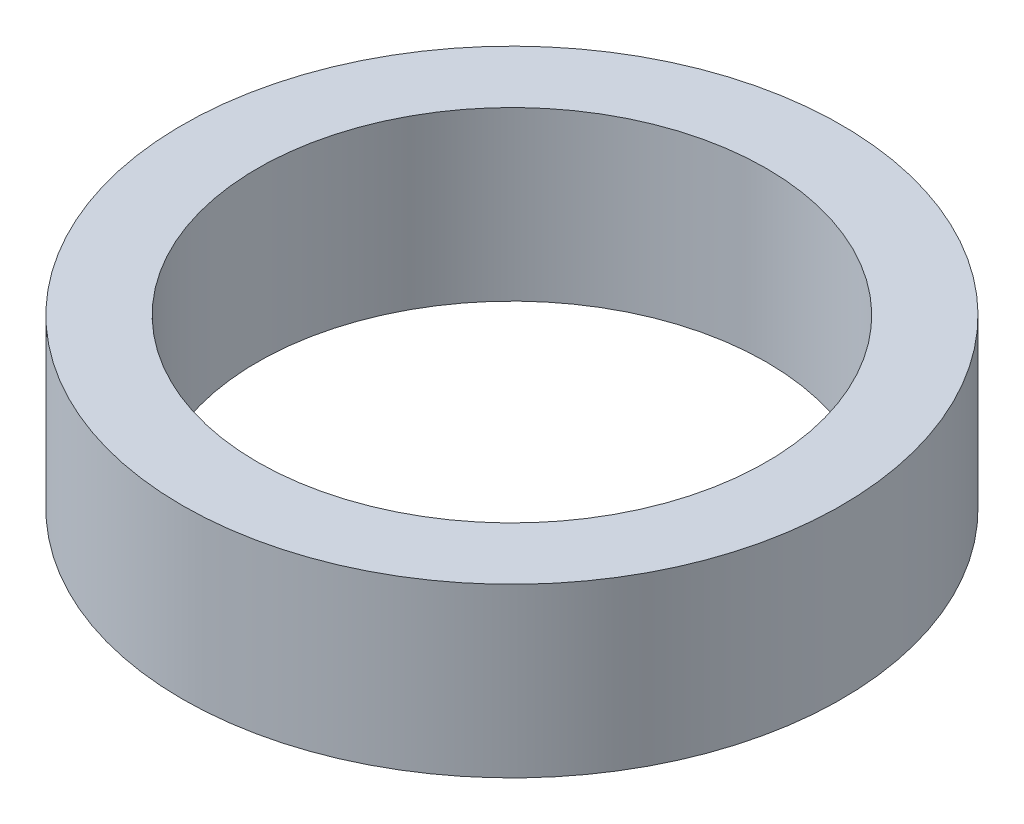
from build123d import *

# Parameters (mm, degrees)
SKETCH1_R           = 28.5
SKETCH1_R_2         = 22
BOSS_EXTRUDE1_DEPTH = 14.5


with BuildPart() as part:
    # Sketch1 → Boss-Extrude1 (new body)
    with BuildSketch(Plane(origin=(0, 0, 0), x_dir=(1, 0, 0), z_dir=(0, 1, 0))):
        with Locations(Location((0, 0, 0), (0, 0, 270))):
            Circle(SKETCH1_R)
        with Locations(Location((0, 0, 0), (0, 0, 270))):
            Circle(SKETCH1_R_2, mode=Mode.SUBTRACT)
    extrude(amount=BOSS_EXTRUDE1_DEPTH)


solid = part.part
